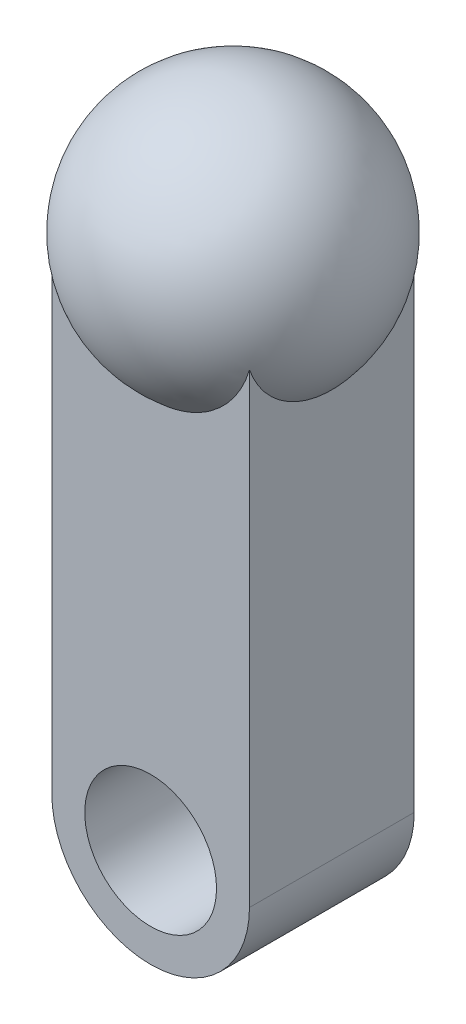
from build123d import *

# Parameters (mm, degrees)
SALIENTE_EXTRUIR1_DEPTH      = 2.5
SALIENTE_EXTRUIR1_DEPTH_BACK = 2.5
CROQUIS1_R                   = 2


with BuildPart() as part:
    # Croquis1 → Saliente-Extruir1 (new, two sides: drawn at the far end of the back side and taken through both)
    with BuildSketch(Plane.XY.offset(-SALIENTE_EXTRUIR1_DEPTH_BACK)):
        with BuildLine():
            Line((3, 15), (3, 0))
            ThreePointArc((3, 0), (0, -3), (-3, 0))
            Line((-3, 0), (-3, 15))
            ThreePointArc((-3, 15), (0, 18), (3, 15))
        make_face()
        Circle(CROQUIS1_R, mode=Mode.SUBTRACT)
        with Locations((0, 15)):
            Circle(CROQUIS1_R, mode=Mode.SUBTRACT)
    extrude(amount=SALIENTE_EXTRUIR1_DEPTH + SALIENTE_EXTRUIR1_DEPTH_BACK)

    # Croquis2 → Revolución1 (revolve)
    with BuildSketch(Plane.XY):
        with BuildLine():
            Line((0, 11), (0, 19))
            ThreePointArc((0, 19), (4, 15), (0, 11))
        make_face()
    revolve(axis=Axis((0, 11, 0), (0, 1, 0)))


solid = part.part
